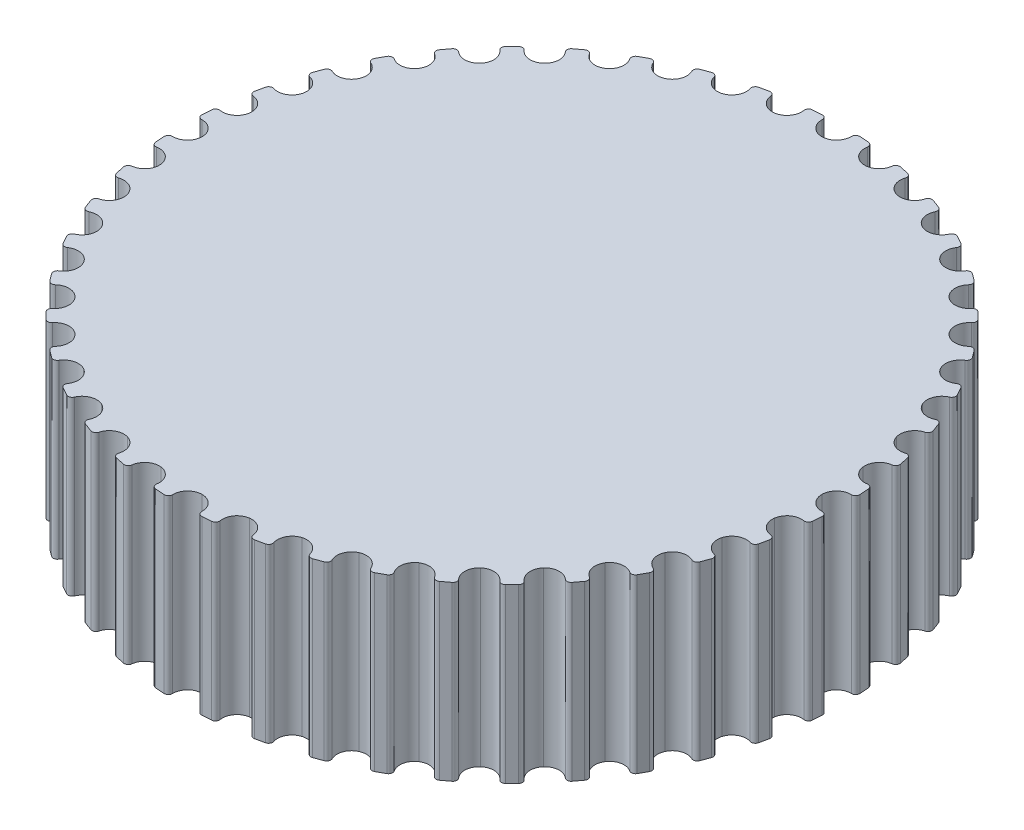
from build123d import *

# Parameters (mm, degrees)
AUFSATZ_LINEAR_AUSTRAGEN1_DEPTH = 18


with BuildPart() as part:
    # Skizze1 → Aufsatz-Linear austragen1 (new body)
    with BuildSketch(Plane(origin=(0, 0, 0), x_dir=(1, 0, 0), z_dir=(0, 1, 0))):
        with BuildLine():
            Line((2.927937922, 34.320291088), (1.985059706, 34.387712032))
            ThreePointArc((1.985059706, 34.387712032), (1.657472537, 34.269837081), (1.524524686, 33.948072063))
            ThreePointArc((1.524524686, 33.948072063), (1.09171537, 32.845207742), (0, 32.385))
            ThreePointArc((0, 32.385), (-1.091729973, 32.845173098), (-1.524574287, 33.948023684))
            ThreePointArc((-1.524574287, 33.948023684), (-1.657532348, 34.269784483), (-1.985123258, 34.387649039))
            Line((-1.985123258, 34.387649039), (-2.927999334, 34.320198174))
            ThreePointArc((-2.927999334, 34.320198174), (-3.235476784, 34.156902505), (-3.321279481, 33.819492139))
            ThreePointArc((-3.321279481, 33.819492139), (-3.592729465, 32.666258199), (-4.607838356, 32.055367412))
            ThreePointArc((-4.607838356, 32.055367412), (-5.753945552, 32.355487237), (-6.339336137, 33.385512225))
            ThreePointArc((-6.339336137, 33.385512225), (-6.516732213, 33.685076058), (-6.857762596, 33.755119876))
            Line((-6.857762596, 33.755119876), (-7.781442294, 33.554170307))
            ThreePointArc((-7.781442294, 33.554170307), (-8.06255067, 33.348778149), (-8.099461517, 33.002591137))
            ThreePointArc((-8.099461517, 33.002591137), (-8.20402623, 31.822464095), (-9.121863953, 31.073326237))
            ThreePointArc((-9.121863953, 31.073326237), (-10.299016934, 31.207283215), (-11.025036927, 32.143514268))
            ThreePointArc((-11.025036927, 32.143514268), (-11.243259746, 32.414782879), (-11.590787205, 32.435580068))
            Line((-11.590787205, 32.435580068), (-12.47646707, 32.105222549))
            ThreePointArc((-12.47646707, 32.105222549), (-12.725483816, 31.861915094), (-12.712751416, 31.513998805))
            ThreePointArc((-12.712751416, 31.513998805), (-12.648302222, 30.331002645), (-13.450184247, 29.458868003))
            ThreePointArc((-13.450184247, 29.458868003), (-14.634419574, 29.423935156), (-15.486289301, 30.247313309))
            ThreePointArc((-15.486289301, 30.247313309), (-15.740896474, 30.484764452), (-16.087846354, 30.455891641))
            Line((-16.087846354, 30.455891641), (-16.917496498, 30.002851299))
            ThreePointArc((-16.917496498, 30.002851299), (-17.129352352, 29.726581584), (-17.067235899, 29.384018591))
            ThreePointArc((-17.067235899, 29.384018591), (-16.835084797, 28.222235703), (-17.504687119, 27.244858424))
            ThreePointArc((-17.504687119, 27.244858424), (-18.671897175, 27.041746884), (-19.632275026, 27.735510531))
            ThreePointArc((-19.632275026, 27.735510531), (-19.918083486, 27.934310385), (-20.257392886, 27.856355342))
            Line((-20.257392886, 27.856355342), (-21.014124026, 27.289854771))
            ThreePointArc((-21.014124026, 27.289854771), (-21.184506212, 26.986246852), (-21.074270218, 26.65601075))
            ThreePointArc((-21.074270218, 26.65601075), (-20.679143136, 25.539091682), (-21.202834582, 24.476368349))
            ThreePointArc((-21.202834582, 24.476368349), (-22.329258338, 24.109212881), (-23.378593787, 24.659238997))
            ThreePointArc((-23.378593787, 24.659238997), (-23.689785299, 24.81534057), (-24.014546859, 24.689890234))
            Line((-24.014546859, 24.689890234), (-24.68295413, 24.021461752))
            ThreePointArc((-24.68295413, 24.021461752), (-24.808394159, 23.696696211), (-24.652282711, 23.385509654))
            ThreePointArc((-24.652282711, 23.385509654), (-24.102223297, 22.336191659), (-24.46934302, 21.209756253))
            ThreePointArc((-24.46934302, 21.209756253), (-25.532049734, 20.686031083), (-26.64898134, 21.081122722))
            ThreePointArc((-26.64898134, 21.081122722), (-26.979220941, 21.191348236), (-27.282823452, 21.020956415))
            Line((-27.282823452, 21.020956415), (-27.849300009, 20.264207299))
            ThreePointArc((-27.849300009, 20.264207299), (-27.927244285, 19.924895425), (-27.728435362, 19.639093274))
            ThreePointArc((-27.728435362, 19.639093274), (-27.034641238, 18.678737439), (-27.237715739, 17.511520938))
            ThreePointArc((-27.237715739, 17.511520938), (-28.215071769, 16.841887601), (-29.376862024, 17.074001836))
            ThreePointArc((-29.376862024, 17.074001836), (-29.719426988, 17.136107418), (-29.995689979, 16.924242798))
            Line((-29.995689979, 16.924242798), (-30.448703993, 16.094578277))
            ThreePointArc((-30.448703993, 16.094578277), (-30.477565794, 15.747627482), (-30.240106572, 15.493027844))
            ThreePointArc((-30.240106572, 15.493027844), (-29.416701387, 14.641184245), (-29.451596655, 13.45694781))
            ThreePointArc((-29.451596655, 13.45694781), (-30.32370585, 12.65503811), (-31.506704055, 12.719449764))
            ThreePointArc((-31.506704055, 12.719449764), (-31.854620747, 12.732171124), (-32.0979203, 12.483146657))
            Line((-32.0979203, 12.483146657), (-32.428249713, 11.597456308))
            ThreePointArc((-32.428249713, 11.597456308), (-32.407441496, 11.249929509), (-32.13616596, 11.031715299))
            ThreePointArc((-32.13616596, 11.031715299), (-31.199911869, 10.305725016), (-31.065917536, 9.128576286))
            ThreePointArc((-31.065917536, 9.128576286), (-31.815026268, 8.210714792), (-32.995149991, 8.10611263))
            ThreePointArc((-32.995149991, 8.10611263), (-33.341335831, 8.069190796), (-33.546719069, 7.788075903))
            Line((-33.546719069, 7.788075903), (-33.747639326, 6.864389828))
            ThreePointArc((-33.747639326, 6.864389828), (-33.677584687, 6.523361669), (-33.378015224, 6.345975099))
            ThreePointArc((-33.378015224, 6.345975099), (-32.34797166, 5.7606172), (-32.047815465, 4.614519528))
            ThreePointArc((-32.047815465, 4.614519528), (-32.65867404, 3.599391253), (-33.811899365, 3.327904673))
            ThreePointArc((-33.811899365, 3.327904673), (-34.149307008, 3.242091269), (-34.31259292, 2.934608637))
            Line((-34.31259292, 2.934608637), (-34.380013864, 1.991730421))
            ThreePointArc((-34.380013864, 1.991730421), (-34.262138913, 1.664143251), (-33.940373895, 1.5311954))
            ThreePointArc((-33.940373895, 1.5311954), (-32.837509574, 1.098386084), (-32.377301832, 0.006670714))
            ThreePointArc((-32.377301832, 0.006670714), (-32.83747493, -1.085059258), (-33.940325516, -1.517903572))
            ThreePointArc((-33.940325516, -1.517903572), (-34.262086315, -1.650861634), (-34.379950871, -1.978452544))
            Line((-34.379950871, -1.978452544), (-34.312500006, -2.92132862))
            ThreePointArc((-34.312500006, -2.92132862), (-34.149204337, -3.228806069), (-33.811793971, -3.314608766))
            ThreePointArc((-33.811793971, -3.314608766), (-32.658560031, -3.586058751), (-32.047669244, -4.601167641))
            ThreePointArc((-32.047669244, -4.601167641), (-32.347789069, -5.747274837), (-33.377814057, -6.332665423))
            ThreePointArc((-33.377814057, -6.332665423), (-33.67737789, -6.510061499), (-33.747421708, -6.851091881))
            Line((-33.747421708, -6.851091881), (-33.546472139, -7.774771579))
            ThreePointArc((-33.546472139, -7.774771579), (-33.341079981, -8.055879955), (-32.994892969, -8.092790803))
            ThreePointArc((-32.994892969, -8.092790803), (-31.814765927, -8.197355516), (-31.065628069, -9.115193238))
            ThreePointArc((-31.065628069, -9.115193238), (-31.199585047, -10.29234622), (-32.1358161, -11.018366213))
            ThreePointArc((-32.1358161, -11.018366213), (-32.407084711, -11.236589031), (-32.4278819, -11.58411649))
            Line((-32.4278819, -11.58411649), (-32.097524381, -12.469796356))
            ThreePointArc((-32.097524381, -12.469796356), (-31.854216926, -12.718813102), (-31.506300637, -12.706080702))
            ThreePointArc((-31.506300637, -12.706080702), (-30.323304477, -12.641631508), (-29.451169835, -13.443513532))
            ThreePointArc((-29.451169835, -13.443513532), (-29.416236988, -14.62774886), (-30.239615141, -15.479618587))
            ThreePointArc((-30.239615141, -15.479618587), (-30.477066284, -15.73422576), (-30.448193473, -16.081175639))
            Line((-30.448193473, -16.081175639), (-29.995153131, -16.910825784))
            ThreePointArc((-29.995153131, -16.910825784), (-29.718883416, -17.122681637), (-29.376320423, -17.060565184))
            ThreePointArc((-29.376320423, -17.060565184), (-28.214537535, -16.828414083), (-27.237160256, -17.498016404))
            ThreePointArc((-27.237160256, -17.498016404), (-27.034048715, -18.665226461), (-27.727812363, -19.625604311))
            ThreePointArc((-27.727812363, -19.625604311), (-27.926612217, -19.911412772), (-27.848657174, -20.250722172))
            Line((-27.848657174, -20.250722172), (-27.282156603, -21.007453311))
            ThreePointArc((-27.282156603, -21.007453311), (-26.978548684, -21.177835498), (-26.648312582, -21.067599504))
            ThreePointArc((-26.648312582, -21.067599504), (-25.531393514, -20.672472422), (-24.468670181, -21.196163868))
            ThreePointArc((-24.468670181, -21.196163868), (-24.101514713, -22.322587623), (-24.651540828, -23.371923073))
            ThreePointArc((-24.651540828, -23.371923073), (-24.807642402, -23.683114584), (-24.682192066, -24.007876145))
            Line((-24.682192066, -24.007876145), (-24.013763584, -24.676283415))
            ThreePointArc((-24.013763584, -24.676283415), (-23.688998043, -24.801723445), (-23.377811486, -24.645611997))
            ThreePointArc((-23.377811486, -24.645611997), (-22.32849349, -24.095552583), (-21.202058085, -24.462672305))
            ThreePointArc((-21.202058085, -24.462672305), (-20.678332915, -25.52537902), (-21.073424554, -26.642310625))
            ThreePointArc((-21.073424554, -26.642310625), (-21.183650068, -26.972550226), (-21.013258247, -27.276152738))
            Line((-21.013258247, -27.276152738), (-20.256509131, -27.842629295))
            ThreePointArc((-20.256509131, -27.842629295), (-19.917197257, -27.920573571), (-19.631395106, -27.721764647))
            ThreePointArc((-19.631395106, -27.721764647), (-18.671039271, -27.027970524), (-17.50382277, -27.231045025))
            ThreePointArc((-17.50382277, -27.231045025), (-16.834189433, -28.208401054), (-17.066303667, -29.370191309))
            ThreePointArc((-17.066303667, -29.370191309), (-17.12840925, -29.712756273), (-16.916544629, -29.989019265))
            Line((-16.916544629, -29.989019265), (-16.086880109, -30.442033279))
            ThreePointArc((-16.086880109, -30.442033279), (-15.739929314, -30.47089508), (-15.485329676, -30.233435858))
            ThreePointArc((-15.485329676, -30.233435858), (-14.633486077, -29.410030673), (-13.449249642, -29.44492594))
            ThreePointArc((-13.449249642, -29.44492594), (-12.647339942, -30.317035135), (-12.711751596, -31.50003334))
            ThreePointArc((-12.711751596, -31.50003334), (-12.724472956, -31.847950033), (-12.475448489, -32.091249586))
            Line((-12.475448489, -32.091249586), (-11.58975814, -32.421578999))
            ThreePointArc((-11.58975814, -32.421578999), (-11.242231341, -32.400770782), (-11.024017131, -32.129495246))
            ThreePointArc((-11.024017131, -32.129495246), (-10.298026848, -31.193241155), (-9.120878118, -31.059246822))
            ThreePointArc((-9.120878118, -31.059246822), (-8.203016624, -31.808355553), (-8.098414461, -32.988479276))
            ThreePointArc((-8.098414461, -32.988479276), (-8.061492628, -33.334665117), (-7.780377735, -33.540048355))
            Line((-7.780377735, -33.540048355), (-6.85669166, -33.740968612))
            ThreePointArc((-6.85669166, -33.740968612), (-6.515663501, -33.670913972), (-6.338276931, -33.37134451))
            ThreePointArc((-6.338276931, -33.37134451), (-5.752919032, -32.341300946), (-4.60682136, -32.041144751))
            ThreePointArc((-4.60682136, -32.041144751), (-3.591693084, -32.652003325), (-3.320206505, -33.805228651))
            ThreePointArc((-3.320206505, -33.805228651), (-3.2343931, -34.142636294), (-2.926910469, -34.305922206))
            Line((-2.926910469, -34.305922206), (-1.984032253, -34.37334315))
            ThreePointArc((-1.984032253, -34.37334315), (-1.656445083, -34.255468198), (-1.523497232, -33.93370318))
            ThreePointArc((-1.523497232, -33.93370318), (-1.090687916, -32.83083886), (0.001027454, -32.370631117))
            ThreePointArc((0.001027454, -32.370631117), (1.092757426, -32.830804216), (1.52560174, -33.933654802))
            ThreePointArc((1.52560174, -33.933654802), (1.658559802, -34.255415601), (1.986150712, -34.373280157))
            Line((1.986150712, -34.373280157), (2.929026788, -34.305829292))
            ThreePointArc((2.929026788, -34.305829292), (3.236504238, -34.142533622), (3.322306935, -33.805123256))
            ThreePointArc((3.322306935, -33.805123256), (3.593756919, -32.651889316), (4.608865809, -32.040998529))
            ThreePointArc((4.608865809, -32.040998529), (5.754973005, -32.341118354), (6.340363591, -33.371143343))
            ThreePointArc((6.340363591, -33.371143343), (6.517759667, -33.670707176), (6.858790049, -33.740750993))
            Line((6.858790049, -33.740750993), (7.782469747, -33.539801425))
            ThreePointArc((7.782469747, -33.539801425), (8.063578123, -33.334409266), (8.100488971, -32.988222254))
            ThreePointArc((8.100488971, -32.988222254), (8.205053684, -31.808095212), (9.122891406, -31.058957355))
            ThreePointArc((9.122891406, -31.058957355), (10.300044388, -31.192914333), (11.026064381, -32.129145385))
            ThreePointArc((11.026064381, -32.129145385), (11.244287199, -32.400413997), (11.591814658, -32.421211185))
            Line((11.591814658, -32.421211185), (12.477494524, -32.090853667))
            ThreePointArc((12.477494524, -32.090853667), (12.72651127, -31.847546211), (12.71377887, -31.499629923))
            ThreePointArc((12.71377887, -31.499629923), (12.649329676, -30.316633762), (13.4512117, -29.444499121))
            ThreePointArc((13.4512117, -29.444499121), (14.635447028, -29.409566274), (15.487316755, -30.232944426))
            ThreePointArc((15.487316755, -30.232944426), (15.741923928, -30.470395569), (16.088873807, -30.441522758))
            Line((16.088873807, -30.441522758), (16.918523952, -29.988482416))
            ThreePointArc((16.918523952, -29.988482416), (17.130379805, -29.712212702), (17.068263352, -29.369649709))
            ThreePointArc((17.068263352, -29.369649709), (16.836112251, -28.20786682), (17.505714572, -27.230489541))
            ThreePointArc((17.505714572, -27.230489541), (18.672924629, -27.027378001), (19.633302479, -27.721141649))
            ThreePointArc((19.633302479, -27.721141649), (19.91911094, -27.919941503), (20.25842034, -27.841986459))
            Line((20.25842034, -27.841986459), (21.015151479, -27.275485889))
            ThreePointArc((21.015151479, -27.275485889), (21.185533666, -26.97187797), (21.075297672, -26.641641867))
            ThreePointArc((21.075297672, -26.641641867), (20.68017059, -25.5247228), (21.203862036, -24.461999466))
            ThreePointArc((21.203862036, -24.461999466), (22.330285791, -24.094843998), (23.379621241, -24.644870114))
            ThreePointArc((23.379621241, -24.644870114), (23.690812752, -24.800971687), (24.015574313, -24.675521351))
            Line((24.015574313, -24.675521351), (24.683981583, -24.00709287))
            ThreePointArc((24.683981583, -24.00709287), (24.809421613, -23.682327329), (24.653310165, -23.371140771))
            ThreePointArc((24.653310165, -23.371140771), (24.103250751, -22.321822776), (24.470370473, -21.19538737))
            ThreePointArc((24.470370473, -21.19538737), (25.533077188, -20.671662201), (26.650008794, -21.066753839))
            ThreePointArc((26.650008794, -21.066753839), (26.980248394, -21.176979354), (27.283850906, -21.006587532))
            Line((27.283850906, -21.006587532), (27.850327463, -20.249838417))
            ThreePointArc((27.850327463, -20.249838417), (27.928271739, -19.910526543), (27.729462815, -19.624724391))
            ThreePointArc((27.729462815, -19.624724391), (27.035668692, -18.664368557), (27.238743193, -17.497152055))
            ThreePointArc((27.238743193, -17.497152055), (28.216099222, -16.827518719), (29.377889477, -17.059632953))
            ThreePointArc((29.377889477, -17.059632953), (29.720454441, -17.121738535), (29.996717433, -16.909873915))
            Line((29.996717433, -16.909873915), (30.449731447, -16.080209394))
            ThreePointArc((30.449731447, -16.080209394), (30.478593248, -15.733258599), (30.241134026, -15.478658961))
            ThreePointArc((30.241134026, -15.478658961), (29.417728841, -14.626815363), (29.452624109, -13.442578928))
            ThreePointArc((29.452624109, -13.442578928), (30.324733303, -12.640669228), (31.507731508, -12.705080881))
            ThreePointArc((31.507731508, -12.705080881), (31.855648201, -12.717802241), (32.098947754, -12.468777774))
            Line((32.098947754, -12.468777774), (32.429277167, -11.583087426))
            ThreePointArc((32.429277167, -11.583087426), (32.40846895, -11.235560627), (32.137193414, -11.017346417))
            ThreePointArc((32.137193414, -11.017346417), (31.200939323, -10.291356134), (31.06694499, -9.114207404))
            ThreePointArc((31.06694499, -9.114207404), (31.816053721, -8.196345909), (32.996177444, -8.091743747))
            ThreePointArc((32.996177444, -8.091743747), (33.342363285, -8.054821914), (33.547746523, -7.77370702))
            Line((33.547746523, -7.77370702), (33.74866678, -6.850020946))
            ThreePointArc((33.74866678, -6.850020946), (33.67861214, -6.508992786), (33.379042678, -6.331606216))
            ThreePointArc((33.379042678, -6.331606216), (32.348999114, -5.746248317), (32.048842919, -4.600150646))
            ThreePointArc((32.048842919, -4.600150646), (32.659701493, -3.58502237), (33.812926819, -3.31353579))
            ThreePointArc((33.812926819, -3.31353579), (34.150334462, -3.227722386), (34.313620374, -2.920239754))
            Line((34.313620374, -2.920239754), (34.381041318, -1.977361538))
            ThreePointArc((34.381041318, -1.977361538), (34.263166367, -1.649774369), (33.941401349, -1.516826518))
            ThreePointArc((33.941401349, -1.516826518), (32.838537028, -1.084017201), (32.378329286, 0.007698168))
            ThreePointArc((32.378329286, 0.007698168), (32.838502384, 1.099428141), (33.94135297, 1.532272455))
            ThreePointArc((33.94135297, 1.532272455), (34.263113769, 1.665230516), (34.380978325, 1.992821426))
            Line((34.380978325, 1.992821426), (34.31352746, 2.935697502))
            ThreePointArc((34.31352746, 2.935697502), (34.15023179, 3.243174952), (33.812821424, 3.328977649))
            ThreePointArc((33.812821424, 3.328977649), (32.659587485, 3.600427633), (32.048696697, 4.615536524))
            ThreePointArc((32.048696697, 4.615536524), (32.348816522, 5.76164372), (33.378841511, 6.347034305))
            ThreePointArc((33.378841511, 6.347034305), (33.678405344, 6.524430382), (33.748449161, 6.865460764))
            Line((33.748449161, 6.865460764), (33.547499593, 7.789140462))
            ThreePointArc((33.547499593, 7.789140462), (33.342107434, 8.070248838), (32.995920422, 8.107159685))
            ThreePointArc((32.995920422, 8.107159685), (31.81579338, 8.211724399), (31.066655523, 9.129562121))
            ThreePointArc((31.066655523, 9.129562121), (31.200612501, 10.306715103), (32.136843553, 11.032735095))
            ThreePointArc((32.136843553, 11.032735095), (32.408112165, 11.250957914), (32.428909353, 11.598485373))
            Line((32.428909353, 11.598485373), (32.098551835, 12.484165238))
            ThreePointArc((32.098551835, 12.484165238), (31.855244379, 12.733181985), (31.507328091, 12.720449584))
            ThreePointArc((31.507328091, 12.720449584), (30.32433193, 12.65600039), (29.452197289, 13.457882415))
            ThreePointArc((29.452197289, 13.457882415), (29.417264442, 14.642117742), (30.240642594, 15.493987469))
            ThreePointArc((30.240642594, 15.493987469), (30.478093737, 15.748594643), (30.449220926, 16.095544522))
            Line((30.449220926, 16.095544522), (29.996180584, 16.925194666))
            ThreePointArc((29.996180584, 16.925194666), (29.71991087, 17.13705052), (29.377347877, 17.074934067))
            ThreePointArc((29.377347877, 17.074934067), (28.215564988, 16.842782965), (27.238187709, 17.512385287))
            ThreePointArc((27.238187709, 17.512385287), (27.035076169, 18.679595344), (27.728839817, 19.639973194))
            ThreePointArc((27.728839817, 19.639973194), (27.927639671, 19.925781654), (27.849684627, 20.265091054))
            Line((27.849684627, 20.265091054), (27.283184057, 21.021822194))
            ThreePointArc((27.283184057, 21.021822194), (26.979576138, 21.19220438), (26.649340035, 21.081968386))
            ThreePointArc((26.649340035, 21.081968386), (25.532420968, 20.686841305), (24.469697634, 21.21053275))
            ThreePointArc((24.469697634, 21.21053275), (24.102542166, 22.336956506), (24.652568282, 23.386291955))
            ThreePointArc((24.652568282, 23.386291955), (24.808669855, 23.697483467), (24.683219519, 24.022245027))
            Line((24.683219519, 24.022245027), (24.014791038, 24.690652298))
            ThreePointArc((24.014791038, 24.690652298), (23.690025497, 24.816092328), (23.378838939, 24.659980879))
            ThreePointArc((23.378838939, 24.659980879), (22.329520944, 24.109921465), (21.203085538, 24.477041188))
            ThreePointArc((21.203085538, 24.477041188), (20.679360369, 25.539747902), (21.074452007, 26.656679508))
            ThreePointArc((21.074452007, 26.656679508), (21.184677522, 26.986919109), (21.014285701, 27.29052162))
            Line((21.014285701, 27.29052162), (20.257536585, 27.856998177))
            ThreePointArc((20.257536585, 27.856998177), (19.918224711, 27.934942453), (19.632422559, 27.73613353))
            ThreePointArc((19.632422559, 27.73613353), (18.672066725, 27.042339406), (17.504850223, 27.245413907))
            ThreePointArc((17.504850223, 27.245413907), (16.835216887, 28.222769937), (17.067331121, 29.384560192))
            ThreePointArc((17.067331121, 29.384560192), (17.129436704, 29.727125156), (16.917572083, 30.003388147))
            Line((16.917572083, 30.003388147), (16.087907562, 30.456402161))
            ThreePointArc((16.087907562, 30.456402161), (15.740956767, 30.485263963), (15.486357129, 30.24780474))
            ThreePointArc((15.486357129, 30.24780474), (14.634513531, 29.424399556), (13.450277096, 29.459294823))
            ThreePointArc((13.450277096, 29.459294823), (12.648367396, 30.331404018), (12.712779049, 31.514402223))
            ThreePointArc((12.712779049, 31.514402223), (12.725500409, 31.862318915), (12.476475942, 32.105618468))
            Line((12.476475942, 32.105618468), (11.590785594, 32.435947881))
            ThreePointArc((11.590785594, 32.435947881), (11.243258795, 32.415139664), (11.025044585, 32.143864128))
            ThreePointArc((11.025044585, 32.143864128), (10.299054302, 31.207610037), (9.121905572, 31.073615704))
            ThreePointArc((9.121905572, 31.073615704), (8.204044077, 31.822724436), (8.099441915, 33.002848159))
            ThreePointArc((8.099441915, 33.002848159), (8.062520082, 33.349033999), (7.781405188, 33.554417237))
            Line((7.781405188, 33.554417237), (6.857719114, 33.755337494))
            ThreePointArc((6.857719114, 33.755337494), (6.516690955, 33.685282855), (6.339304385, 33.385713393))
            ThreePointArc((6.339304385, 33.385713393), (5.753946485, 32.355669828), (4.607848814, 32.055513634))
            ThreePointArc((4.607848814, 32.055513634), (3.592720538, 32.666372208), (3.321233958, 33.819597533))
            ThreePointArc((3.321233958, 33.819597533), (3.235420554, 34.157005176), (2.927937922, 34.320291088))
        make_face()
    extrude(amount=AUFSATZ_LINEAR_AUSTRAGEN1_DEPTH)


solid = part.part
